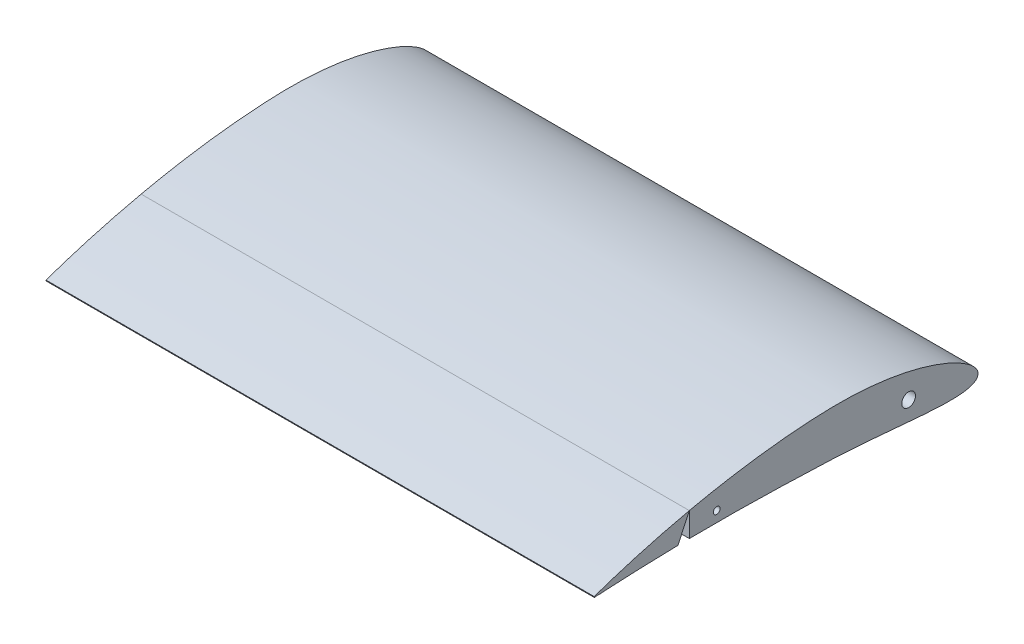
from build123d import *

# Parameters (mm, degrees)
BOSS_EXTRUDE1_DEPTH      = 254
BOSS_EXTRUDE1_DEPTH_BACK = 254
CUT_EXTRUDE1_REACH       = 623.109
SKETCH5_R                = 6.35
CUT_EXTRUDE3_DEPTH       = 101.6
SKETCH6_R                = 3.175
CUT_EXTRUDE4_DEPTH       = 127


with BuildPart() as part:
    # Sketch1 → Boss-Extrude1 (new, two sides: drawn at the far end of the back side and taken through both)
    with BuildSketch(Plane(origin=(0, 0, 0), x_dir=(0, 0, -1), z_dir=(1, 0, 0)).offset(-BOSS_EXTRUDE1_DEPTH_BACK)):
        with BuildLine():
            Line((-354.787327228, -0.030257196), (-354.876173011, 0.410417887))
            add(Edge.make_bspline(
                [(-354.876173011, 0.410417887), (-354.559877309, 0.519388), (-353.29965963, 0.95355787), (-350.47872665, 1.927095868), (-345.800950265, 3.497798274), (-336.024074692, 6.721551148), (-319.654473712, 11.798891927), (-300.598349456, 17.130600639), (-282.422876264, 21.724272526), (-261.175777938, 26.651569731), (-238.622276389, 31.145528798), (-208.774809213, 36.004755717), (-183.96165787, 39.090454058), (-158.902335219, 41.113212891), (-140.096691022, 42.111376668), (-121.516747473, 42.228858195), (-103.422167262, 41.321050632), (-86.188408528, 39.478676181), (-70.043450957, 36.810480574), (-55.199760436, 33.432905997), (-41.843390777, 29.510854383), (-30.130463623, 25.220125297), (-20.187014188, 20.73431935), (-12.107203154, 16.226289935), (-5.926897661, 11.855341958), (-1.679224073, 7.716499794), (0.765838065, 3.796757813), (0.987487677, -0.148325216), (-1.35108726, -3.308943186), (-5.450780885, -5.288085739), (-11.087315968, -6.587464624), (-18.34911979, -7.268527656), (-27.163826626, -7.404874951), (-37.447057223, -7.053797092), (-49.083078017, -6.301866785), (-61.95239395, -5.238034817), (-75.929862643, -3.983911698), (-96.406736552, -2.153555858), (-117.937239158, -0.458414508), (-140.484776897, 0.674535203), (-158.296467959, 1.286744043), (-176.48388462, 1.917893193), (-200.671973719, 2.586246563), (-224.541124114, 2.979106232), (-247.830237405, 3.028480659), (-264.337268621, 2.907447598), (-279.933149694, 2.656365926), (-294.437996632, 2.282890374), (-307.681856469, 1.852126627), (-319.513378006, 1.371074809), (-329.767358246, 0.912902227), (-338.388880463, 0.426846955), (-345.076973543, 0.191518705), (-350.227621538, -0.406394891), (-352.780150329, -0.035387827), (-354.744619464, -0.75811662), (-354.777220059, -0.20251155), (-354.787327228, -0.030257196)],
                knots=[0, 0, 0, 0, 0.001371577, 0.005464776, 0.012234802, 0.021601969, 0.04767125, 0.082496261, 0.102719149, 0.124527079, 0.171912573, 0.19697838, 0.248496767, 0.274385101, 0.300041178, 0.325689988, 0.350525088, 0.374279703, 0.396711254, 0.417576734, 0.436654006, 0.45374439, 0.468679994, 0.481329415, 0.491630702, 0.499615789, 0.505546281, 0.510184984, 0.514824194, 0.520701508, 0.52851604, 0.538465752, 0.550542609, 0.564643256, 0.580638139, 0.598344876, 0.617584458, 0.638174401, 0.682632113, 0.706120665, 0.730727383, 0.755700244, 0.780731769, 0.829932396, 0.853570292, 0.876213105, 0.897609987, 0.917519394, 0.935698347, 0.951942678, 0.966047159, 0.97783994, 0.987174002, 0.993931501, 0.998018399, 0.999385644, 1, 1, 1, 1], degree=3))
        make_face()
    extrude(amount=BOSS_EXTRUDE1_DEPTH + BOSS_EXTRUDE1_DEPTH_BACK)

    # Sketch2 → Cut-Extrude1 (cut, up to next)
    with BuildSketch(Plane.ZY.offset(254), mode=Mode.PRIVATE) as cut_extrude1_sk1:
        Polygon((266.7, 25.310988042), (266.7, 2.06571301), (277.539449763, 2.06571301), align=None)
    cut_extrude1_tool1 = extrude(cut_extrude1_sk1.sketch, amount=-CUT_EXTRUDE1_REACH, mode=Mode.PRIVATE) & part.part
    add(cut_extrude1_tool1.solids().sort_by_distance((-254, 9.814138, 270.31315))[0], mode=Mode.SUBTRACT)


with BuildPart() as cut_extrude1_piece_1:
    # of the separate pieces the step leaves, piece 1, a body of its own (cut_extrude1_pieces)
    add(part.part.solids().sort_by_distance((0, 2.854788865, 266.7))[0])

    # Sketch5 → Cut-Extrude3 (cut)
    with BuildSketch(Plane(origin=(254, 0, 0), x_dir=(0, 0, -1), z_dir=(1, 0, 0))):
        with Locations((-63.5, 12.7)):
            Circle(SKETCH5_R)
    extrude(amount=-CUT_EXTRUDE3_DEPTH, mode=Mode.SUBTRACT)

    # Sketch6 → Cut-Extrude4 (cut)
    with BuildSketch(Plane(origin=(254, 0, 0), x_dir=(0, 0, -1), z_dir=(1, 0, 0))):
        with Locations((-241.3, 12.7)):
            Circle(SKETCH6_R)
    extrude(amount=-CUT_EXTRUDE4_DEPTH, mode=Mode.SUBTRACT)


with BuildPart() as cut_extrude1_piece_2:
    # of the separate pieces the step leaves, piece 2, a body of its own (cut_extrude1_pieces)
    add(part.part.solids().sort_by_distance((0, -0.030257196, 354.787327228))[0])


solid = Compound([cut_extrude1_piece_1.part, cut_extrude1_piece_2.part])
